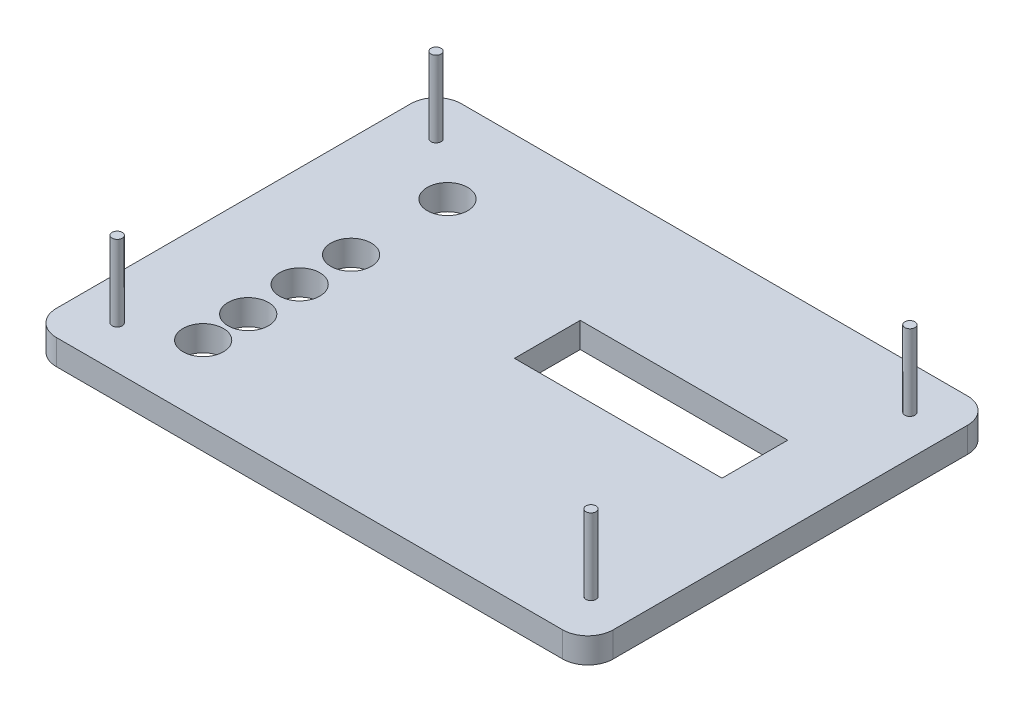
from build123d import *

# Parameters (mm, degrees)
SKETCH1_W           = 110
SKETCH1_H           = 80
SKETCH1_R           = 4
BOSS_EXTRUDE1_DEPTH = 5
SKETCH2_R           = 1
BOSS_EXTRUDE2_DEPTH = 15
FILLET1_R           = 5
SKETCH3_W           = 41
SKETCH3_H           = 13
CUT_EXTRUDE2_DEPTH  = 5


with BuildPart() as part:
    # Sketch1 → Boss-Extrude1 (new body)
    with BuildSketch(Plane(origin=(0, 0, 0), x_dir=(1, 0, 0), z_dir=(0, 1, 0))):
        Rectangle(SKETCH1_W, SKETCH1_H)
        with Locations(Location((-35.06, 22.32, 0), (0, 0, 270))):
            Circle(SKETCH1_R, mode=Mode.SUBTRACT)
        with Locations(Location((-35.06, 3.27, 0), (0, 0, 270))):
            Circle(SKETCH1_R, mode=Mode.SUBTRACT)
        with Locations(Location((-35.06, -6.89, 0), (0, 0, 270))):
            Circle(SKETCH1_R, mode=Mode.SUBTRACT)
        with Locations(Location((-35.06, -17.05, 0), (0, 0, 270))):
            Circle(SKETCH1_R, mode=Mode.SUBTRACT)
        with Locations(Location((-35.06, -25.95, 0), (0, 0, 270))):
            Circle(SKETCH1_R, mode=Mode.SUBTRACT)
    extrude(amount=BOSS_EXTRUDE1_DEPTH)

    # Sketch2 → Boss-Extrude2 (add)
    with BuildSketch(Plane(origin=(0, 5, 0), x_dir=(1, 0, 0), z_dir=(0, 1, 0))):
        with Locations(Location((47.1, 31.5, 0), (0, 0, 90))):
            Circle(SKETCH2_R)
        with Locations(Location((47.1, -31.5, 0), (0, 0, 90))):
            Circle(SKETCH2_R)
        with Locations(Location((-46.5, 31.5, 0), (0, 0, 90))):
            Circle(SKETCH2_R)
        with Locations(Location((-46.5, -31.5, 0), (0, 0, 90))):
            Circle(SKETCH2_R)
    extrude(amount=BOSS_EXTRUDE2_DEPTH)

    # Fillet1
    fillet1_edges = [part.edges().sort_by_distance(p)[0] for p in [
        (55, 2.5, 40),
        (-55, 2.5, 40),
        (-55, 2.5, -40),
        (55, 2.5, -40),
    ]]
    fillet(fillet1_edges, radius=FILLET1_R)

    # Sketch3 → Cut-Extrude2 (cut)
    with BuildSketch(Plane.XZ):
        with Locations((19.3, -8.18)):
            Rectangle(SKETCH3_W, SKETCH3_H)
    extrude(amount=-CUT_EXTRUDE2_DEPTH, mode=Mode.SUBTRACT)


solid = part.part
